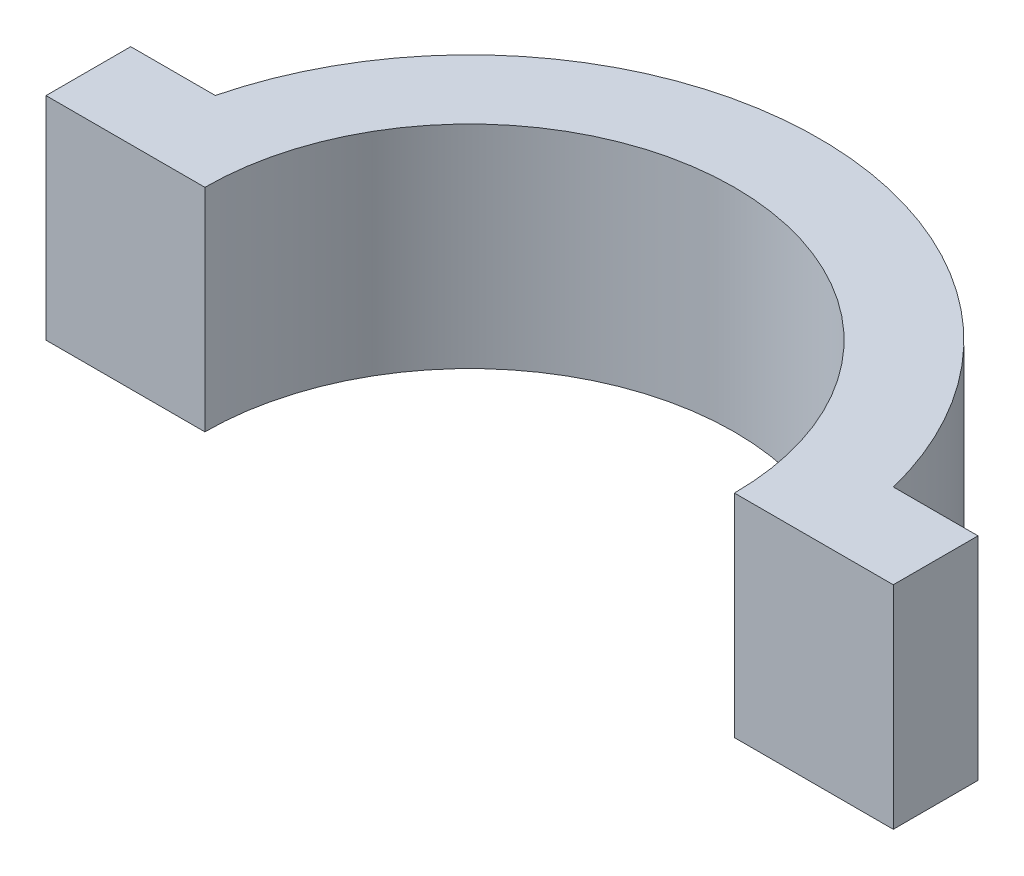
from build123d import *

# Parameters (mm, degrees)
BOSS_EXTRUDE1_DEPTH = 10


with BuildPart() as part:
    # Sketch1 → Boss-Extrude1 (new body)
    with BuildSketch(Plane(origin=(0, 0, 0), x_dir=(1, 0, 0), z_dir=(0, 1, 0))):
        with BuildLine():
            Line((3.992189406, 4), (0, 4))
            Line((0, 4), (0, 0))
            Line((0, 0), (3.5, 0))
            Line((3.5, 0), (7.5, 0))
            ThreePointArc((7.5, 0), (20, 12.5), (32.5, 0))
            Line((32.5, 0), (36.5, 0))
            Line((36.5, 0), (40, 0))
            Line((40, 0), (40, 4))
            Line((40, 4), (36.007810594, 4))
            ThreePointArc((36.007810594, 4), (20, 16.5), (3.992189406, 4))
        make_face()
    extrude(amount=BOSS_EXTRUDE1_DEPTH)


solid = part.part
